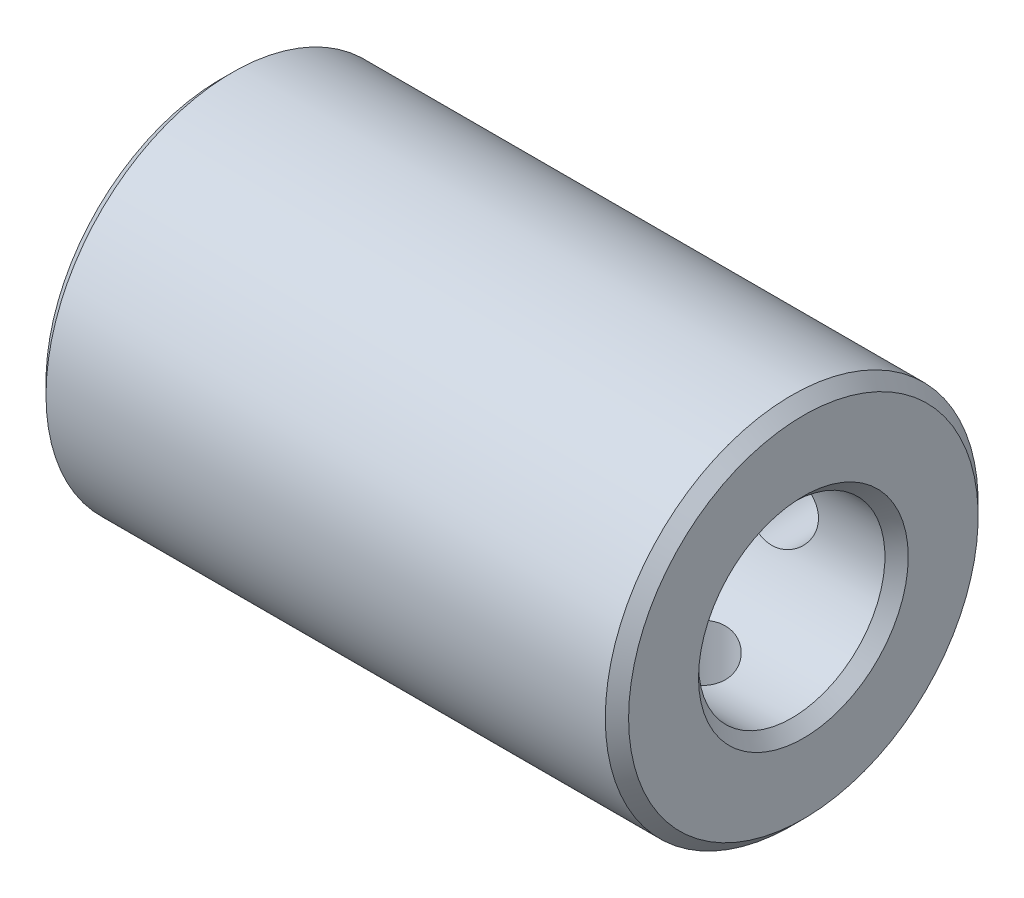
from build123d import *

# Parameters (mm, degrees)
CHAMFER_1_SIZE      = 0.5
SKETCH_2_R          = 1.65
CUT_EXTRUDE_1_DEPTH = 10
SKETCH_3_R          = 1.65
CUT_EXTRUDE_2_DEPTH = 10


with BuildPart() as part:
    # 草图1 → 旋转1 (revolve)
    with BuildSketch(Plane(origin=(0, 0, 0), x_dir=(1, 0, 0), z_dir=(0, 1, 0)), mode=Mode.PRIVATE) as revolve_1_sk:
        Polygon((25, 8), (0, 8), (0, 2.5), (12.5, 2.5), (12.5, 4), (25, 4), align=None)
    revolve(revolve_1_sk.sketch.rotate(Axis((-10.524691358, 0, 0), (1, 0, 0)), 180), axis=Axis((-10.524691358, 0, 0), (1, 0, 0)))

    # 倒角1
    chamfer_1_edges = [part.edges().sort_by_distance(p)[0] for p in [
        (25, 0, -4),
        (12.5, 0, -2.5),
        (0, 0, -2.5),
        (0, 0, -8),
        (25, 0, -8),
    ]]
    chamfer(chamfer_1_edges, length=CHAMFER_1_SIZE)

    # 草图2 → 切除-拉伸1 (cut)
    with BuildSketch(Plane(origin=(0, 0, 0), x_dir=(1, 0, 0), z_dir=(0, 1, 0))):
        with Locations(Location((5, 0, 0), (0, 0, 270))):
            Circle(SKETCH_2_R)
        with Locations(Location((20, 0, 0), (0, 0, 270))):
            Circle(SKETCH_2_R)
    extrude(amount=-CUT_EXTRUDE_1_DEPTH, mode=Mode.SUBTRACT)

    # 草图3 → 切除-拉伸2 (cut)
    with BuildSketch(Plane.XY):
        with Locations((5, 0)):
            Circle(SKETCH_3_R)
        with Locations((20, 0)):
            Circle(SKETCH_3_R)
    extrude(amount=-CUT_EXTRUDE_2_DEPTH, mode=Mode.SUBTRACT)


solid = part.part
